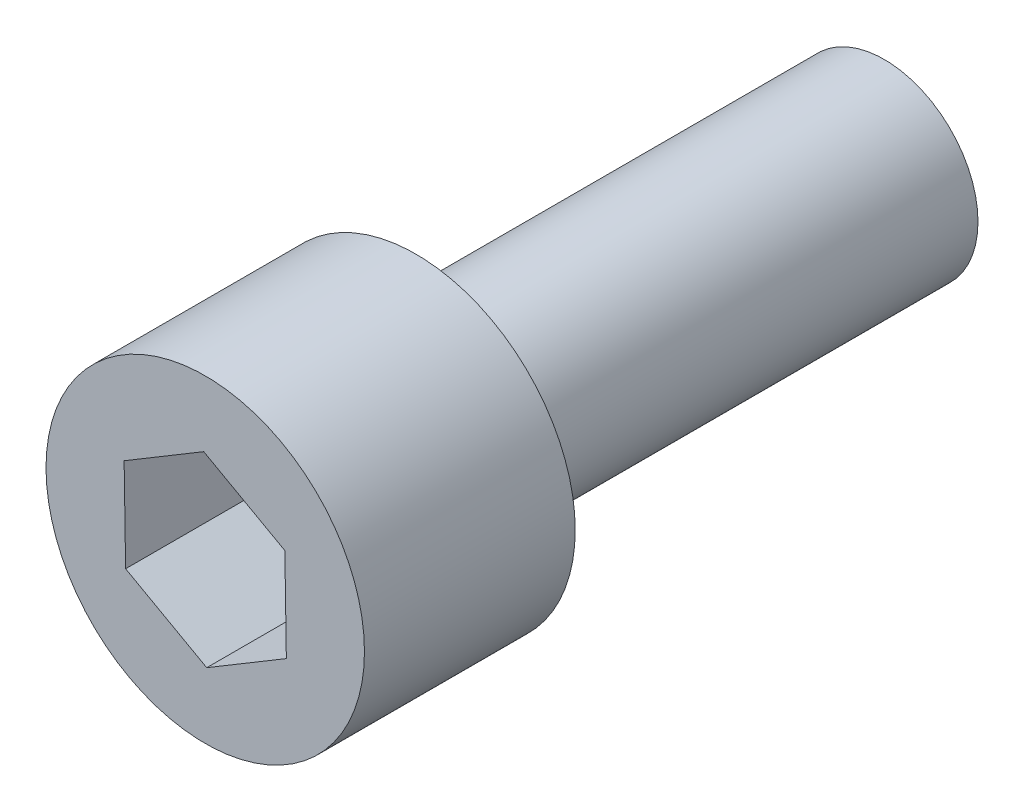
from build123d import *

# Parameters (mm, degrees)
SKETCH_1_R      = 2
EXTRUDE_1_DEPTH = 10
SKETCH_2_R      = 3.4
EXTRUDE_2_DEPTH = 4.5


with BuildPart() as part:
    # 草图1 → 拉伸1 (new body)
    with BuildSketch(Plane.XY):
        Circle(SKETCH_1_R)
    extrude(amount=EXTRUDE_1_DEPTH)

    # 草图2 → 拉伸2 (add)
    with BuildSketch(Plane.XY.offset(10)):
        Circle(SKETCH_2_R)
        Polygon((-0.031811461, 1.981453179), (-1.73189452, 0.963177056), (-1.700083059, -1.018276123), (0.031811461, -1.981453179), (1.73189452, -0.963177056), (1.700083059, 1.018276123), align=None, mode=Mode.SUBTRACT)
    extrude(amount=EXTRUDE_2_DEPTH)


solid = part.part
